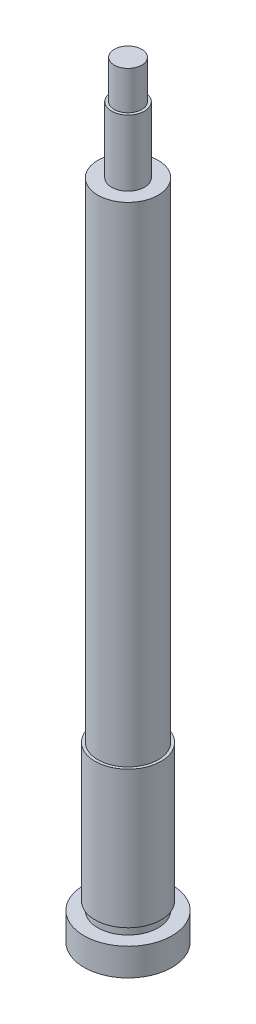
from build123d import *


with BuildPart() as part:
    # Sketch1 → Revolve1 (revolve)
    with BuildSketch(Plane.XY, mode=Mode.PRIVATE) as revolve1_sk:
        Polygon((0, 0), (-16, 0), (-16, 10), (-11, 10), (-11, 13), (-12, 13), (-12, 63), (-11, 63), (-11, 241), (-6, 241), (-6, 265), (-5, 265), (-5, 279), (0, 279), align=None)
    revolve(revolve1_sk.sketch.rotate(Axis((0, 0, 0), (0, 1, 0)), 270), axis=Axis((0, 0, 0), (0, 1, 0)))


solid = part.part
